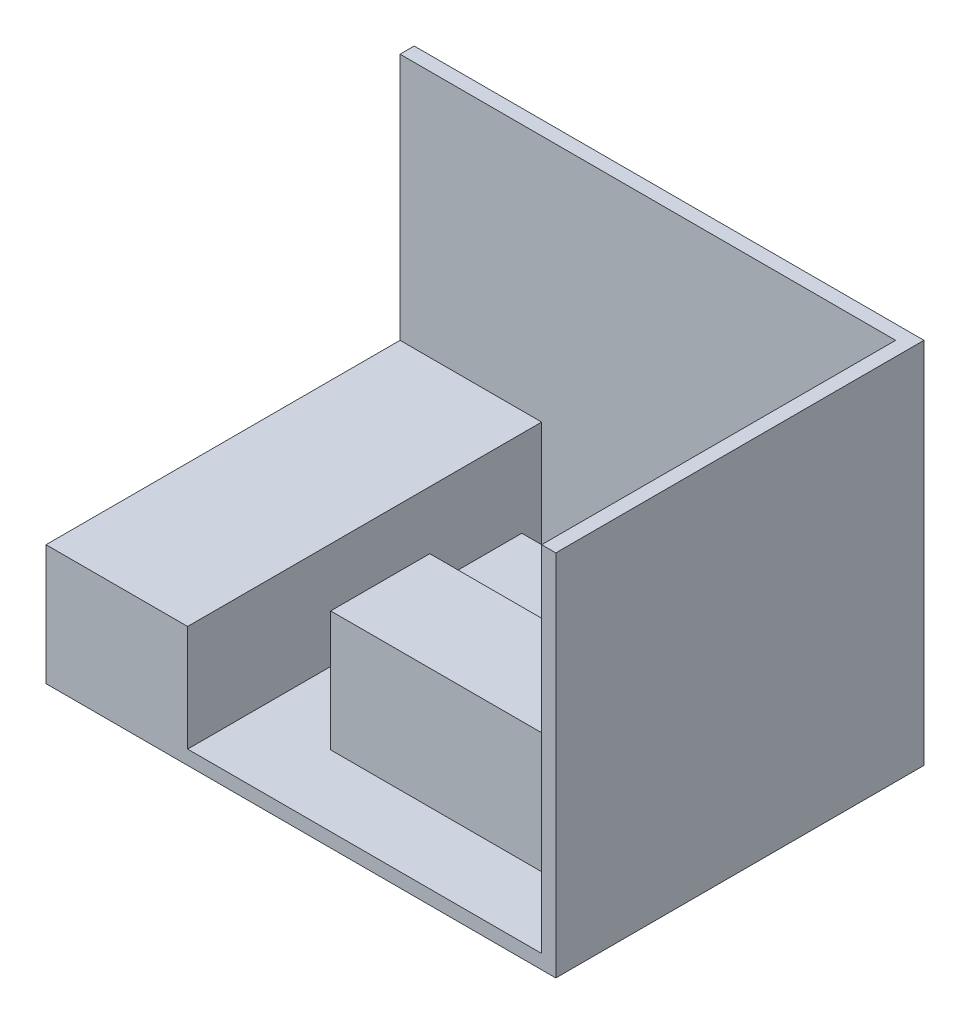
from build123d import *

# Parameters (mm, degrees)
SKETCH1_W           = 3600
SKETCH1_H           = 2600
BOSS_EXTRUDE1_DEPTH = 100
BOSS_EXTRUDE2_DEPTH = 2500
SKETCH4_W           = 2000
SKETCH4_H           = 700
BOSS_EXTRUDE3_DEPTH = 850
SKETCH5_W           = 1000
SKETCH5_H           = 2500
BOSS_EXTRUDE4_DEPTH = 750
SKETCH6_W           = 700
SKETCH6_H           = 500
BOSS_EXTRUDE5_DEPTH = 750


with BuildPart() as part:
    # Sketch1 → Boss-Extrude1 (new body)
    with BuildSketch(Plane(origin=(0, 0, 0), x_dir=(1, 0, 0), z_dir=(0, 1, 0))):
        with Locations((1800, 1300)):
            Rectangle(SKETCH1_W, SKETCH1_H)
    extrude(amount=BOSS_EXTRUDE1_DEPTH)

    # Sketch2 → Boss-Extrude2 (add)
    with BuildSketch(Plane(origin=(0, 100, 0), x_dir=(1, 0, 0), z_dir=(0, 1, 0))):
        Polygon((3600, 0), (3500, 0), (3500, 2500), (0, 2500), (0, 2600), (3600, 2600), align=None)
    extrude(amount=BOSS_EXTRUDE2_DEPTH)

    # Sketch4 → Boss-Extrude3 (add)
    with BuildSketch(Plane(origin=(0, 100, 0), x_dir=(1, 0, 0), z_dir=(0, 1, 0))):
        with Locations((2510, 850)):
            Rectangle(SKETCH4_W, SKETCH4_H)
    extrude(amount=BOSS_EXTRUDE3_DEPTH)

    # Sketch5 → Boss-Extrude4 (add)
    with BuildSketch(Plane(origin=(0, 100, 0), x_dir=(1, 0, 0), z_dir=(0, 1, 0))):
        with Locations((500, 1250)):
            Rectangle(SKETCH5_W, SKETCH5_H)
    extrude(amount=BOSS_EXTRUDE4_DEPTH)

    # Sketch6 → Boss-Extrude5 (add)
    with BuildSketch(Plane(origin=(0, 100, 0), x_dir=(1, 0, 0), z_dir=(0, 1, 0))):
        with Locations((1960, 1500)):
            Rectangle(SKETCH6_W, SKETCH6_H)
    extrude(amount=BOSS_EXTRUDE5_DEPTH)


solid = part.part
